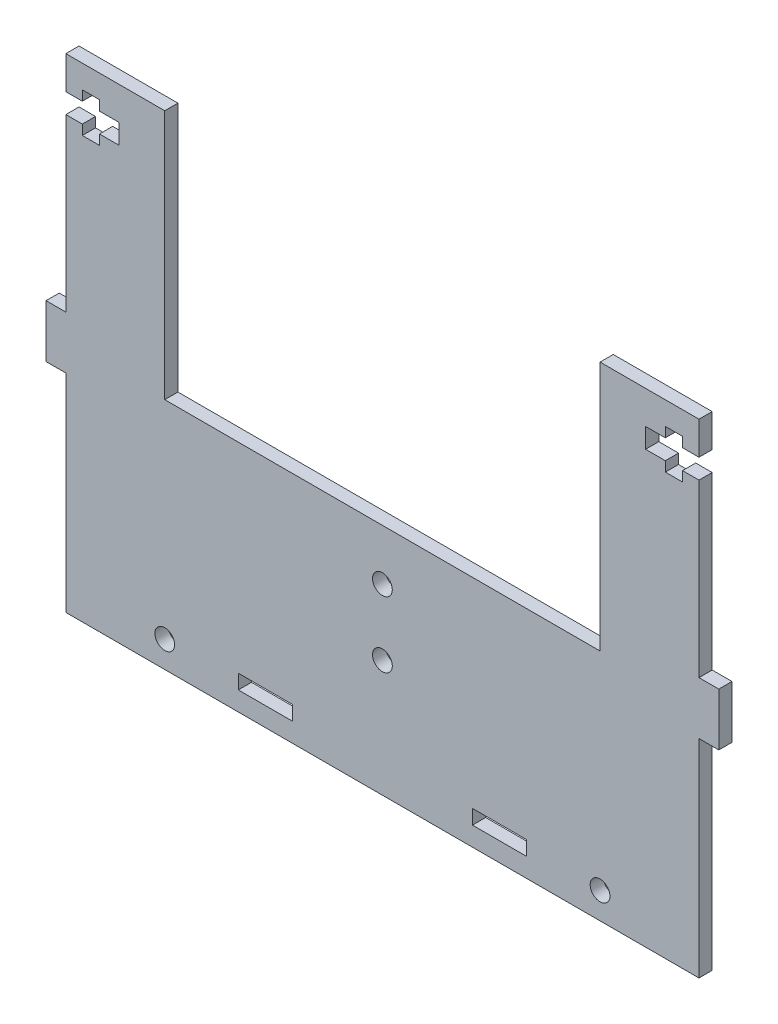
from build123d import *

# Parameters (mm, degrees)
SKETCH_1_R      = 1.5
SKETCH_1_W      = 8.2
SKETCH_1_H      = 2.2
EXTRUDE_1_DEPTH = 2


with BuildPart() as part:
    # 草图1 → 凸台-拉伸1 (new body)
    with BuildSketch(Plane.XY):
        Polygon((-47.766155614, -53.199512395), (-47.766155614, -54.699512395), (-45.166155614, -54.699512395), (-45.166155614, -53.199512395), (-42.166155614, -53.199512395), (-42.166155614, -50.199512395), (-45.166155614, -50.199512395), (-45.166155614, -48.699512395), (-47.766155614, -48.699512395), (-47.766155614, -50.199512395), (-50.266155614, -50.199512395), (-50.266155614, -45.199512395), (-35.266155614, -45.199512395), (-35.266155614, -83.137012395), (30.733844386, -83.137012395), (30.733844386, -45.199512395), (45.733844386, -45.199512395), (45.733844386, -50.199512395), (43.233844386, -50.199512395), (43.233844386, -48.699512395), (40.633844386, -48.699512395), (40.633844386, -50.199512395), (37.633844386, -50.199512395), (37.633844386, -53.199512395), (40.633844386, -53.199512395), (40.633844386, -54.699512395), (43.233844386, -54.699512395), (43.233844386, -53.199512395), (45.733844386, -53.199512395), (45.733844386, -79.137012395), (48.733844386, -79.137012395), (48.733844386, -87.137012395), (45.733844386, -87.137012395), (45.733844386, -118.574512395), (-50.266155614, -118.574512395), (-50.266155614, -87.137012395), (-53.266155614, -87.137012395), (-53.266155614, -79.137012395), (-50.266155614, -79.137012395), (-50.266155614, -53.199512395), align=None)
        with Locations((-35.266155614, -114.574512395)):
            Circle(SKETCH_1_R, mode=Mode.SUBTRACT)
        with Locations(Location((30.733844386, -114.574512395, 0), (0, 0, 180))):
            Circle(SKETCH_1_R, mode=Mode.SUBTRACT)
        with Locations((-2.266155614, -100.855762395)):
            Circle(SKETCH_1_R, mode=Mode.SUBTRACT)
        with Locations((-2.266155614, -90.855762395)):
            Circle(SKETCH_1_R, mode=Mode.SUBTRACT)
        with Locations((-20.016155614, -114.574512396)):
            Rectangle(SKETCH_1_W, SKETCH_1_H, mode=Mode.SUBTRACT)
        with Locations((15.483844386, -114.574512396)):
            Rectangle(SKETCH_1_W, SKETCH_1_H, mode=Mode.SUBTRACT)
    extrude(amount=EXTRUDE_1_DEPTH)


solid = part.part
